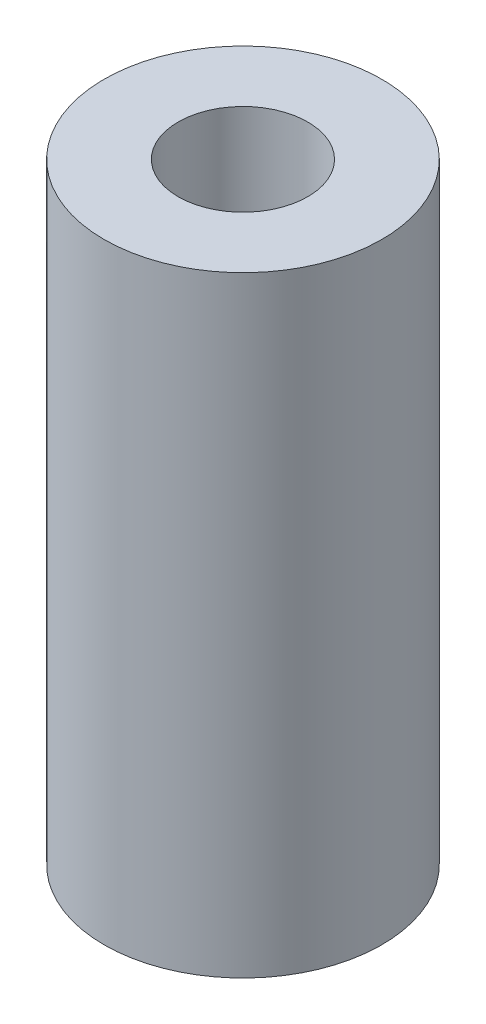
from build123d import *

# Parameters (mm, degrees)
SKETCH_2_R      = 3.75
SKETCH_2_R_2    = 1.75
EXTRUDE_1_DEPTH = 16.5


with BuildPart() as part:
    # 草图2 → 凸台-拉伸1 (new body)
    with BuildSketch(Plane(origin=(0, 0, 0), x_dir=(1, 0, 0), z_dir=(0, 1, 0))):
        with Locations(Location((0, 0, 0), (0, 0, 270))):
            Circle(SKETCH_2_R)
        with Locations(Location((0, 0, 0), (0, 0, 270))):
            Circle(SKETCH_2_R_2, mode=Mode.SUBTRACT)
    extrude(amount=EXTRUDE_1_DEPTH)


solid = part.part
